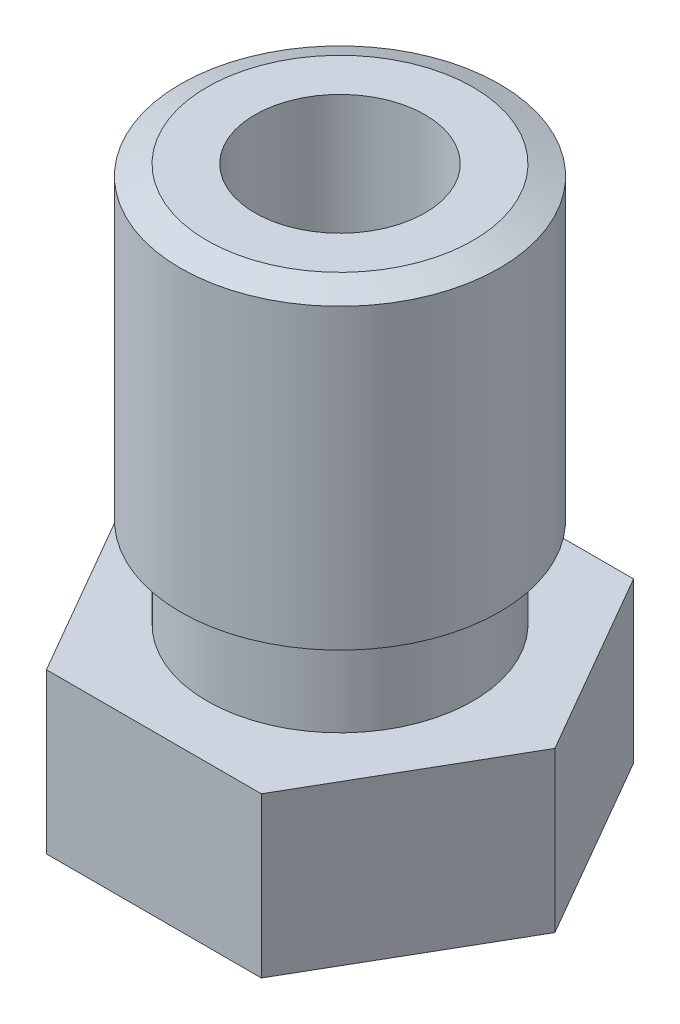
from build123d import *

# Parameters (mm, degrees)
BOSS_EXTRUDE1_DEPTH = 3


with BuildPart() as part:
    # Sketch1 → Revolve1 (revolve)
    with BuildSketch(Plane.XY, mode=Mode.PRIVATE) as revolve1_sk:
        Polygon((0, 0), (0.5, 0), (1.900415076, 2), (3.5, 2), (3.5, 5), (2.5, 5), (2.5, 6.5), (3, 6.7), (3, 12.3), (2.5, 12.5), (0, 12.5), align=None)
    revolve(revolve1_sk.sketch.rotate(Axis((0, 0, 0), (0, 1, 0)), 90), axis=Axis((0, 0, 0), (0, 1, 0)))

    # Sketch2 → Boss-Extrude1 (add)
    with BuildSketch(Plane(origin=(0, 5, 0), x_dir=(1, 0, 0), z_dir=(0, 1, 0))):
        Polygon((2.020725942, 3.5), (-2.020725942, 3.5), (-4.041451884, 0), (-2.020725942, -3.5), (2.020725942, -3.5), (4.041451884, 0), align=None)
    extrude(amount=-BOSS_EXTRUDE1_DEPTH)

    # Sketch3 → Cut-Revolve1 (revolve, cut)
    with BuildSketch(Plane.XY, mode=Mode.PRIVATE) as cut_revolve1_sk:
        Polygon((0, 0), (0.2, 0), (0.2, 0.8), (0.75, 1.117542648), (0.75, 1.909252271), (1.6, 2.4), (1.6, 12.5), (0, 12.5), align=None)
    revolve(cut_revolve1_sk.sketch.rotate(Axis((0, 0, 0), (0, 1, 0)), 90), axis=Axis((0, 0, 0), (0, 1, 0)), mode=Mode.SUBTRACT)


solid = part.part
